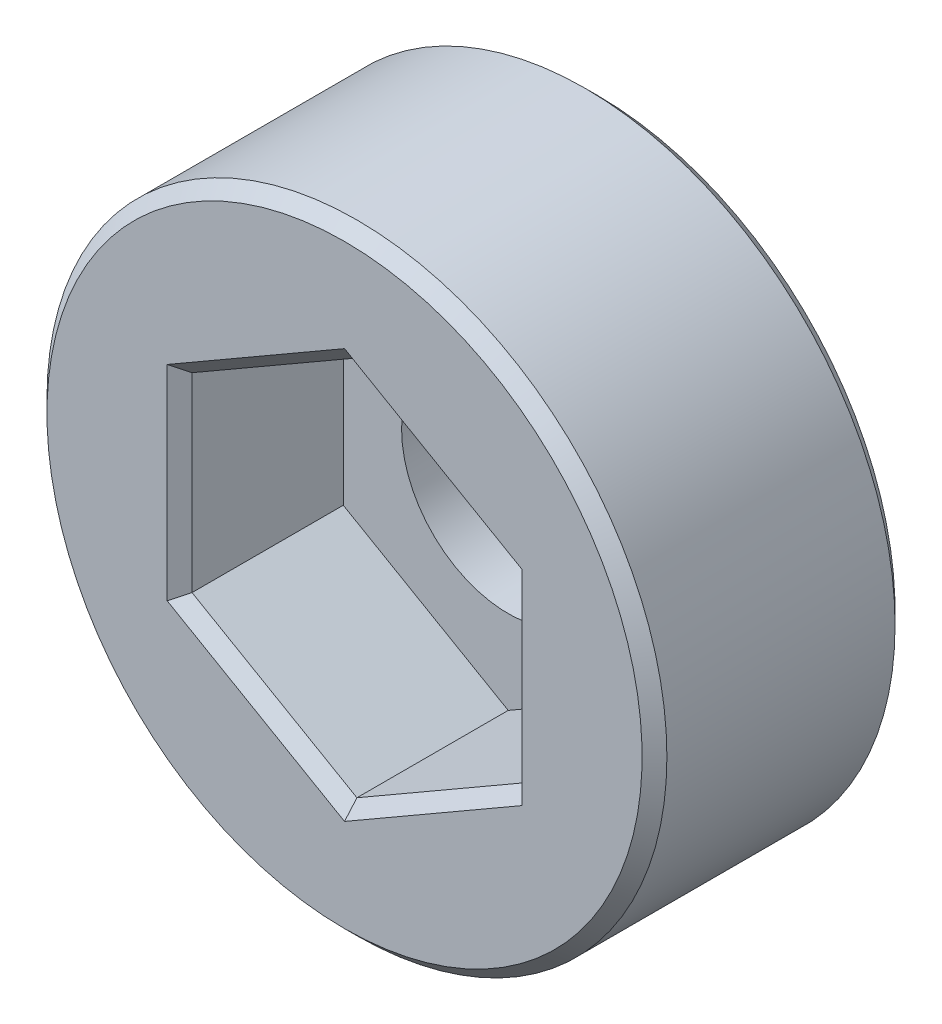
from build123d import *

# Parameters (mm, degrees)
SKETCH4_W          = 10.2
SKETCH4_H          = 12.5
CUT_EXTRUDE1_DEPTH = 6.6
SKETCH6_R          = 4.3
CUT_EXTRUDE2_DEPTH = 19.869552194
CHAMFER2_SIZE      = 0.5


with BuildPart() as part:
    # Sketch4 → Revolve1 (revolve)
    with BuildSketch(Plane(origin=(0, 0, 0), x_dir=(0, 0, -1), z_dir=(1, 0, 0)), mode=Mode.PRIVATE) as revolve1_sk:
        with Locations((-5.1, 6.25)):
            Rectangle(SKETCH4_W, SKETCH4_H)
    revolve(revolve1_sk.sketch.rotate(Axis((0, 0, 10.2), (0, 0, -1)), 180), axis=Axis((0, 0, 10.2), (0, 0, -1)))

    # Sketch5 → Cut-Extrude1 (cut)
    with BuildSketch(Plane.XY.offset(10.2)):
        Polygon((0, -7.67875858), (6.65, -3.83937929), (6.65, 3.83937929), (0, 7.67875858), (-6.65, 3.83937929), (-6.65, -3.83937929), align=None)
    extrude(amount=-CUT_EXTRUDE1_DEPTH, mode=Mode.SUBTRACT)

    # Sketch6 → Cut-Extrude2 (cut, through all)
    with BuildSketch(Plane.XY.offset(3.6)):
        Circle(SKETCH6_R)
    extrude(amount=-CUT_EXTRUDE2_DEPTH, mode=Mode.SUBTRACT)

    # Chamfer2
    chamfer2_edges = [part.edges().sort_by_distance(p)[0] for p in [
        (-3.325, -5.759068935, 10.2),
        (3.325, -5.759068935, 10.2),
        (6.65, 0, 10.2),
        (3.325, 5.759068935, 10.2),
        (-3.325, 5.759068935, 10.2),
        (-6.65, 0, 10.2),
        (-4.3, 0, 0),
        (0, 12.5, 0),
        (0, 12.5, 10.2),
    ]]
    chamfer(chamfer2_edges, length=CHAMFER2_SIZE)


solid = part.part
